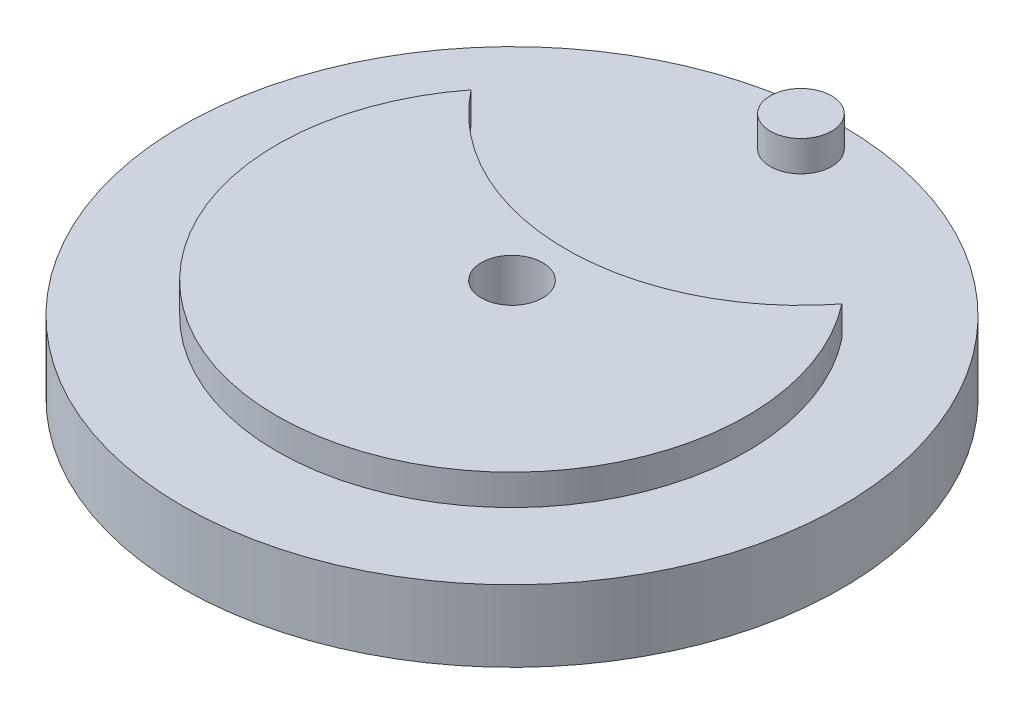
from build123d import *

# Parameters (mm, degrees)
SKETCH1_R           = 64.5
BOSS_EXTRUDE1_DEPTH = 14
SKETCH2_R           = 46
BOSS_EXTRUDE2_DEPTH = 6
SKETCH3_R           = 46
CUT_EXTRUDE3_DEPTH  = 6
SKETCH4_R           = 6
BOSS_EXTRUDE3_DEPTH = 6
SKETCH6_R           = 6
CUT_EXTRUDE2_DEPTH  = 94.383617407


with BuildPart() as part:
    # Sketch1 → Boss-Extrude1 (new body)
    with BuildSketch(Plane(origin=(0, 0, 0), x_dir=(1, 0, 0), z_dir=(0, 1, 0))):
        with Locations(Location((0, 0, 0), (0, 0, 270))):
            Circle(SKETCH1_R)
    extrude(amount=BOSS_EXTRUDE1_DEPTH)

    # Sketch2 → Boss-Extrude2 (add)
    with BuildSketch(Plane(origin=(0, 14, 0), x_dir=(1, 0, 0), z_dir=(0, 1, 0))):
        with Locations(Location((0, 0, 0), (0, 0, 270))):
            Circle(SKETCH2_R)
    extrude(amount=BOSS_EXTRUDE2_DEPTH)

    # Sketch3 → Cut-Extrude3 (cut)
    with BuildSketch(Plane(origin=(0, 20, 0), x_dir=(1, 0, 0), z_dir=(0, 1, 0))):
        with Locations((0, 56.55)):
            Circle(SKETCH3_R)
    extrude(amount=-CUT_EXTRUDE3_DEPTH, mode=Mode.SUBTRACT)

    # Sketch4 → Boss-Extrude3 (add)
    with BuildSketch(Plane(origin=(0, 14, 0), x_dir=(1, 0, 0), z_dir=(0, 1, 0))):
        with Locations(Location((0, 56.55, 0), (0, 0, 270))):
            Circle(SKETCH4_R)
    extrude(amount=BOSS_EXTRUDE3_DEPTH)

    # Sketch6 → Cut-Extrude2 (cut, through all)
    with BuildSketch(Plane(origin=(0, 20, 0), x_dir=(1, 0, 0), z_dir=(0, 1, 0))):
        with Locations(Location((0, 0, 0), (0, 0, 270))):
            Circle(SKETCH6_R)
    extrude(amount=-CUT_EXTRUDE2_DEPTH, mode=Mode.SUBTRACT)


solid = part.part
